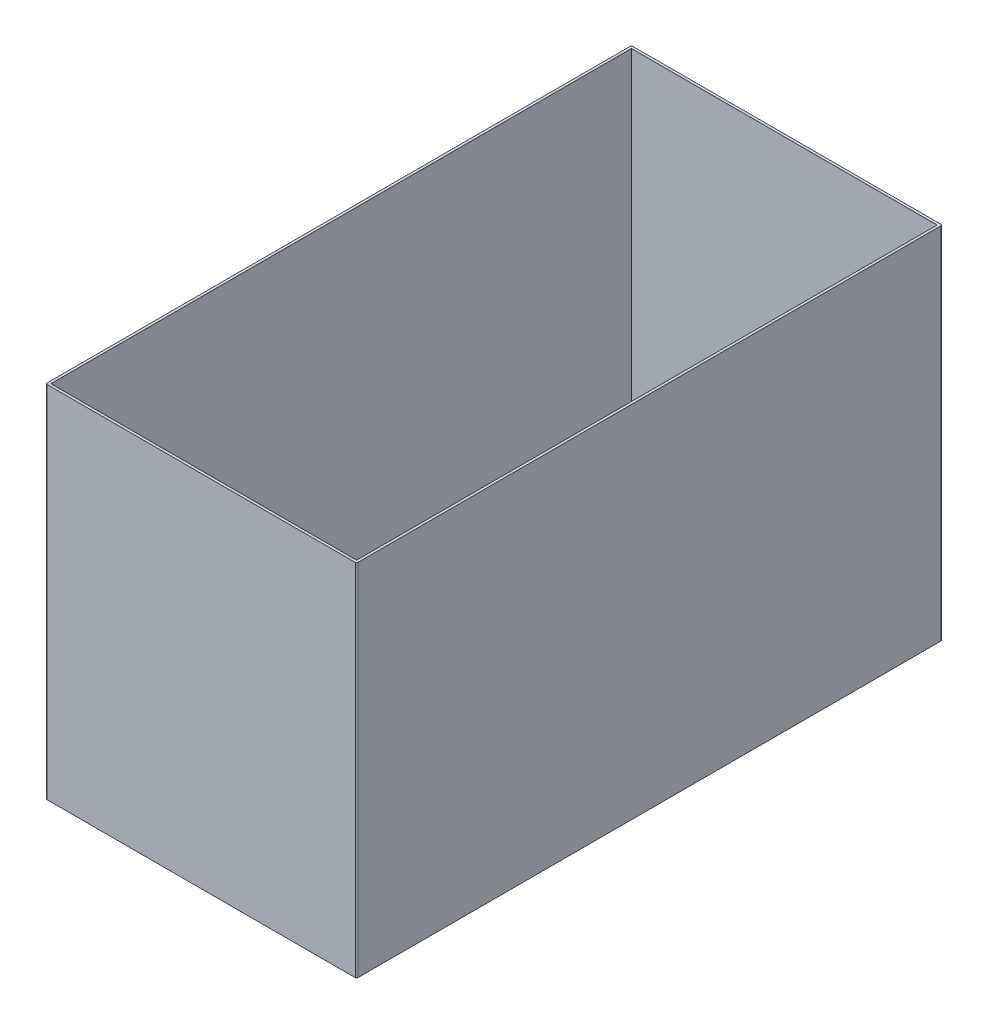
from build123d import *

# Parameters (mm, degrees)
SKETCH1_W           = 12.1
SKETCH1_H           = 22.8
SKETCH1_W_2         = 11.9
SKETCH1_H_2         = 22.6
EXTRUDE_THIN1_DEPTH = 7
FILLET1_R           = 0.05


with BuildPart() as part:
    # Sketch1 → Extrude-Thin1 (new, symmetric)
    with BuildSketch(Plane(origin=(0, 0, 0), x_dir=(1, 0, 0), z_dir=(0, 1, 0))):
        Rectangle(SKETCH1_W, SKETCH1_H)
        Rectangle(SKETCH1_W_2, SKETCH1_H_2, mode=Mode.SUBTRACT)
    extrude(amount=EXTRUDE_THIN1_DEPTH, both=True)

    # Fillet1
    fillet1_edges = [part.edges().sort_by_distance(p)[0] for p in [
        (-6.05, 0, -11.4),
        (6.05, 0, -11.4),
        (6.05, 0, 11.4),
        (-6.05, 0, 11.4),
    ]]
    fillet(fillet1_edges, radius=FILLET1_R)


solid = part.part
